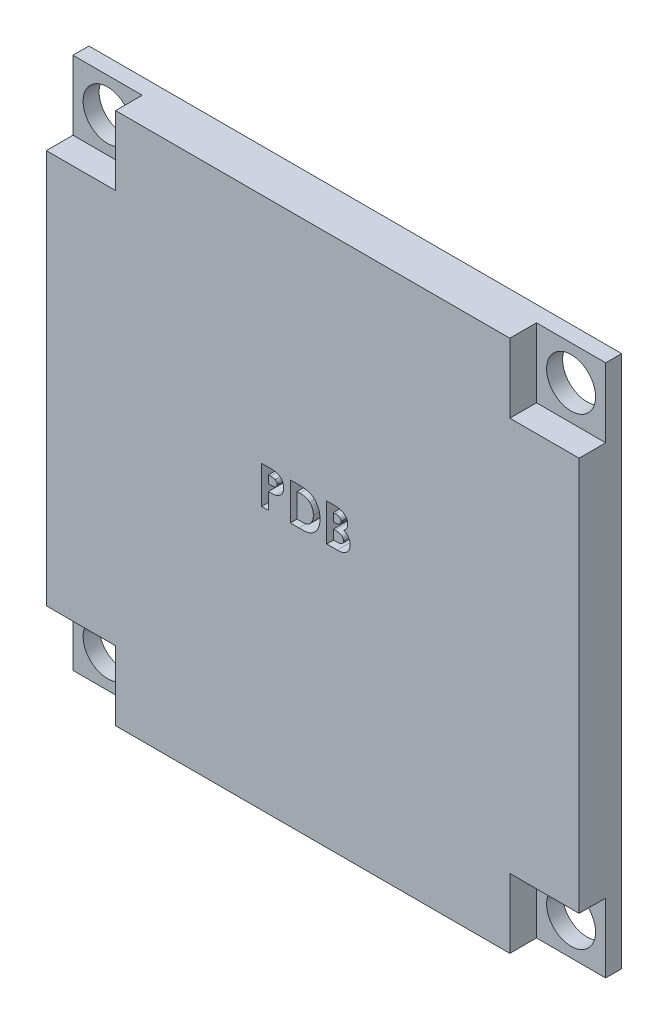
from build123d import *

# Parameters (mm, degrees)
SKETCH1_W           = 50
SKETCH1_H           = 50
BOSS_EXTRUDE1_DEPTH = 4
SKETCH2_W           = 6.5
SKETCH2_H           = 6.5
CUT_EXTRUDE1_DEPTH  = 2.5
SKETCH3_R           = 2.298097039
CUT_EXTRUDE2_DEPTH  = 2.5
CUT_EXTRUDE3_DEPTH  = 2


with BuildPart() as part:
    # Sketch1 → Boss-Extrude1 (new body)
    with BuildSketch(Plane.XY):
        Rectangle(SKETCH1_W, SKETCH1_H)
    extrude(amount=BOSS_EXTRUDE1_DEPTH)

    # Sketch2 → Cut-Extrude1 (cut)
    with BuildSketch(Plane.XY.offset(4)):
        with Locations((21.75, 21.75)):
            Rectangle(SKETCH2_W, SKETCH2_H)
        with Locations((21.75, -21.75)):
            Rectangle(SKETCH2_W, SKETCH2_H)
        with Locations((-21.75, -21.75)):
            Rectangle(SKETCH2_W, SKETCH2_H)
        with Locations((-21.75, 21.75)):
            Rectangle(SKETCH2_W, SKETCH2_H)
    extrude(amount=-CUT_EXTRUDE1_DEPTH, mode=Mode.SUBTRACT)

    # Sketch3 → Cut-Extrude2 (cut)
    with BuildSketch(Plane.XY.offset(1.5)):
        with Locations((-21.75, 21.75)):
            Circle(SKETCH3_R)
        with Locations((21.75, 21.75)):
            Circle(SKETCH3_R)
        with Locations((21.75, -21.75)):
            Circle(SKETCH3_R)
        with Locations((-21.75, -21.75)):
            Circle(SKETCH3_R)
    extrude(amount=-CUT_EXTRUDE2_DEPTH, mode=Mode.SUBTRACT)

    # Sketch4 → Cut-Extrude3 (cut)
    # profile 1 of 3: a face of its own
    with BuildSketch(Plane.XY.offset(4)):
        with BuildLine():
            Line((-4.787653568, 3.184666124), (-4.086531773, 3.184666124))
            add(Edge.make_bspline(
                [(-4.086531773, 3.184666124), (-4.040721385, 3.184461067), (-3.952343543, 3.184065469), (-3.824895424, 3.179268317), (-3.707318293, 3.170671528), (-3.599639165, 3.160047256), (-3.501902315, 3.14515244), (-3.413985345, 3.1280767), (-3.335870012, 3.107273478), (-3.266675449, 3.082580343), (-3.204575564, 3.053468101), (-3.145809043, 3.022461485), (-3.091704017, 2.985456183), (-3.039529642, 2.946440469), (-2.992268816, 2.901687186), (-2.946973126, 2.854174731), (-2.905560969, 2.802018798), (-2.867840455, 2.745850721), (-2.833622137, 2.686708246), (-2.803726725, 2.624485644), (-2.779477241, 2.559084454), (-2.759134939, 2.490927748), (-2.742795804, 2.420018495), (-2.731919956, 2.345920598), (-2.724532533, 2.269151436), (-2.723880694, 2.216902296), (-2.723551004, 2.190475419)],
                knots=[0, 0, 0, 0, 1.698747864, 3.27724071, 4.728299578, 6.070144658, 7.288476769, 8.393259625, 9.389771311, 10.283485332, 11.113357557, 11.931608583, 12.74405601, 13.541433047, 14.344816069, 15.154114104, 15.974336324, 16.810834471, 17.661136416, 18.50621059, 19.367396281, 20.244825668, 21.142564693, 22.063065223, 23.020325768, 24, 24, 24, 24], degree=3))
            add(Edge.make_bspline(
                [(-2.723551004, 2.190475419), (-2.724028025, 2.161239995), (-2.724965429, 2.103788794), (-2.734155016, 2.019572381), (-2.749853733, 1.939279656), (-2.770371134, 1.862233497), (-2.798981192, 1.789701482), (-2.831666839, 1.719952977), (-2.871880553, 1.654943515), (-2.91783115, 1.593859906), (-2.968014444, 1.536205511), (-3.023621784, 1.483644993), (-3.083593271, 1.435820047), (-3.147581752, 1.392229465), (-3.215827457, 1.352961178), (-3.288281144, 1.317647482), (-3.365437569, 1.287417816), (-3.419166982, 1.271607946), (-3.446407574, 1.263592406)],
                knots=[0, 0, 0, 0, 1.102006807, 2.165578795, 3.188629044, 4.184801286, 5.166646146, 6.124351954, 7.085497154, 8.042432466, 9.003981491, 9.963833307, 10.922997304, 11.89326795, 12.880200226, 13.889073926, 14.929769137, 16, 16, 16, 16], degree=3))
            add(Edge.make_bspline(
                [(-3.446407574, 1.263592406), (-3.464349795, 1.259128353), (-3.503218424, 1.249457775), (-3.567535327, 1.239639712), (-3.641653806, 1.230612606), (-3.725813533, 1.222854901), (-3.820063029, 1.21758147), (-3.924311035, 1.213463154), (-4.038604795, 1.210468714), (-4.118080156, 1.210362458), (-4.15944844, 1.21030715)],
                knots=[0, 0, 0, 0, 0.618981996, 1.340914327, 2.176866532, 3.120127938, 4.170906482, 5.338178032, 6.614476169, 8, 8, 8, 8], degree=3))
            Line((-4.15944844, 1.21030715), (-4.15944844, -0.315333876))
            Line((-4.15944844, -0.315333876), (-4.787653568, -0.315333876))
            Line((-4.787653568, -0.315333876), (-4.787653568, 3.184666124))
        make_face()
        with BuildLine():
            Line((-4.15944844, 1.838512278), (-3.937192831, 1.838512278))
            add(Edge.make_bspline(
                [(-3.937192831, 1.838512278), (-3.896749914, 1.838768718), (-3.822334346, 1.83924057), (-3.720708958, 1.846063831), (-3.639040842, 1.856484329), (-3.574521514, 1.871429732), (-3.523577393, 1.894111361), (-3.479641279, 1.920349734), (-3.441956151, 1.953527436), (-3.409326378, 1.991438638), (-3.383239857, 2.03500051), (-3.365150214, 2.08350373), (-3.353399537, 2.135929194), (-3.352314253, 2.172413847), (-3.351756132, 2.191176541)],
                knots=[0, 0, 0, 0, 1.8619151, 3.425951444, 4.686033666, 5.651700536, 6.461346321, 7.243864085, 7.999046032, 8.762387399, 9.539336099, 10.322741239, 11.137448474, 12, 12, 12, 12], degree=3))
            add(Edge.make_bspline(
                [(-3.351756132, 2.191176541), (-3.352308512, 2.207569263), (-3.353380262, 2.239375084), (-3.36125363, 2.285278773), (-3.373801514, 2.328070481), (-3.391982915, 2.367303304), (-3.415487162, 2.402910581), (-3.444143595, 2.434878284), (-3.477584497, 2.463891028), (-3.503402828, 2.479247917), (-3.516519754, 2.487049938)],
                knots=[0, 0, 0, 0, 1.102301479, 2.1387299, 3.123554645, 4.094223062, 5.036071848, 5.982632524, 6.975082478, 8, 8, 8, 8], degree=3))
            add(Edge.make_bspline(
                [(-3.516519754, 2.487049938), (-3.527630547, 2.492668985), (-3.551154374, 2.504565659), (-3.591217732, 2.518396412), (-3.637450234, 2.530064176), (-3.690164004, 2.539748307), (-3.74914875, 2.547264199), (-3.814393948, 2.553011975), (-3.885995614, 2.55532338), (-3.935790288, 2.556071332), (-3.961732094, 2.556460996)],
                knots=[0, 0, 0, 0, 0.656809284, 1.390599849, 2.23162475, 3.173112763, 4.218524733, 5.370385145, 6.63003504, 8, 8, 8, 8], degree=3))
            Line((-3.961732094, 2.556460996), (-4.15944844, 2.556460996))
            Line((-4.15944844, 2.556460996), (-4.15944844, 1.838512278))
        make_face(mode=Mode.SUBTRACT)
    # profile 2 of 3: a face of its own
    with BuildSketch(Plane.XY.offset(4)):
        with BuildLine():
            Line((-2.095345876, 3.184666124), (-1.303779369, 3.184666124))
            add(Edge.make_bspline(
                [(-1.303779369, 3.184666124), (-1.242067656, 3.184234738), (-1.122778215, 3.183400864), (-0.949951415, 3.17400511), (-0.789244484, 3.159555106), (-0.640553827, 3.139676507), (-0.504184283, 3.113371677), (-0.380311698, 3.080377423), (-0.268520327, 3.042291046), (-0.1675844, 2.997474695), (-0.075439607, 2.94522328), (0.012054815, 2.8870194), (0.094727073, 2.820730874), (0.17373734, 2.747636542), (0.248065973, 2.666399165), (0.31895081, 2.578364328), (0.384656268, 2.482255405), (0.447168481, 2.380376784), (0.503702459, 2.272296713), (0.553013507, 2.158935148), (0.594321672, 2.041021613), (0.627886694, 1.918430442), (0.654641891, 1.791568601), (0.673361963, 1.660180095), (0.684934898, 1.524386566), (0.686108875, 1.432352625), (0.686705406, 1.385587599)],
                knots=[0, 0, 0, 0, 1.44355588, 2.790409838, 4.047694926, 5.217575253, 6.298404546, 7.294384826, 8.214239204, 9.058592145, 9.873746385, 10.689560431, 11.514393297, 12.350027578, 13.205127629, 14.088021785, 14.991911688, 15.926770944, 16.882954281, 17.842803888, 18.816321264, 19.80318086, 20.814351908, 21.847355356, 22.906180909, 24, 24, 24, 24], degree=3))
            add(Edge.make_bspline(
                [(0.686705406, 1.385587599), (0.685143366, 1.319599103), (0.6820684, 1.189696887), (0.656166596, 0.999066882), (0.614274609, 0.816329008), (0.555370671, 0.642912713), (0.482345556, 0.480362295), (0.395108879, 0.331544261), (0.294939732, 0.197257392), (0.183005093, 0.078170326), (0.06180714, -0.024186622), (-0.064141973, -0.111847857), (-0.19606922, -0.180976055), (-0.312315561, -0.22481367), (-0.413115642, -0.252076874), (-0.501617022, -0.268189691), (-0.60214556, -0.282966115), (-0.715638597, -0.294385017), (-0.841598263, -0.304567872), (-0.980526636, -0.31010084), (-1.131973905, -0.314697914), (-1.237168353, -0.315116334), (-1.291860299, -0.315333876)],
                knots=[0, 0, 0, 0, 1.315458931, 2.589557908, 3.828601765, 5.048913369, 6.235739168, 7.376350998, 8.481830359, 9.569842114, 10.627874879, 11.640079404, 12.624025415, 13.590060155, 14.111227486, 14.704434459, 15.382649715, 16.137166398, 16.978595427, 17.902333227, 18.909396075, 20, 20, 20, 20], degree=3))
            Line((-1.291860299, -0.315333876), (-2.095345876, -0.315333876))
            Line((-2.095345876, -0.315333876), (-2.095345876, 3.184666124))
        make_face()
        with BuildLine():
            Line((-1.467140748, 2.556460996), (-1.467140748, 0.312871253))
            Line((-1.467140748, 0.312871253), (-1.139015748, 0.312871253))
            add(Edge.make_bspline(
                [(-1.139015748, 0.312871253), (-1.099973912, 0.312942793), (-1.024883464, 0.31308039), (-0.916469856, 0.319634244), (-0.816214757, 0.326212506), (-0.724394147, 0.338698267), (-0.640339784, 0.352606526), (-0.565206354, 0.371961773), (-0.497445031, 0.39229282), (-0.437883507, 0.418176764), (-0.383330004, 0.447310864), (-0.332819691, 0.481444841), (-0.284063098, 0.519349335), (-0.237971767, 0.562139171), (-0.194371255, 0.609247731), (-0.15351953, 0.660917745), (-0.114871329, 0.716991566), (-0.079418678, 0.777765671), (-0.047021856, 0.84259827), (-0.018282244, 0.910861367), (0.005547135, 0.983123445), (0.025352656, 1.058708044), (0.039505946, 1.138273214), (0.051215094, 1.221229627), (0.057251501, 1.30790595), (0.058079961, 1.366883417), (0.058500278, 1.396805547)],
                knots=[0, 0, 0, 0, 1.50275155, 2.890291501, 4.180787663, 5.369391935, 6.45668281, 7.458360028, 8.354766181, 9.177074746, 9.954075863, 10.732690366, 11.5210699, 12.329727389, 13.151100085, 13.990027547, 14.863562427, 15.770965086, 16.696477834, 17.652329173, 18.619756807, 19.62365428, 20.657822005, 21.729286259, 22.847956731, 24, 24, 24, 24], degree=3))
            add(Edge.make_bspline(
                [(0.058500278, 1.396805547), (0.057663148, 1.442658384), (0.05603081, 1.532067863), (0.040288891, 1.662294721), (0.014664049, 1.784922816), (-0.02190013, 1.899497043), (-0.067990412, 2.006339416), (-0.125683144, 2.104544753), (-0.192495452, 2.195762769), (-0.245328803, 2.249274185), (-0.271728087, 2.276012278)],
                knots=[0, 0, 0, 0, 1.13821349, 2.219428113, 3.251817212, 4.244760574, 5.201143372, 6.134805572, 7.068016741, 8, 8, 8, 8], degree=3))
            add(Edge.make_bspline(
                [(-0.271728087, 2.276012278), (-0.297760281, 2.298796749), (-0.35092809, 2.345331449), (-0.444273291, 2.401091921), (-0.547134867, 2.450082961), (-0.661865985, 2.488927393), (-0.787357817, 2.519647225), (-0.924357796, 2.540833942), (-1.072132258, 2.554448302), (-1.174506962, 2.555775725), (-1.227357094, 2.556460996)],
                knots=[0, 0, 0, 0, 0.813307809, 1.661089106, 2.549956539, 3.493439533, 4.508053171, 5.589449661, 6.755572447, 8, 8, 8, 8], degree=3))
            Line((-1.227357094, 2.556460996), (-1.467140748, 2.556460996))
        make_face(mode=Mode.SUBTRACT)
    # profile 3 of 3: a face of its own
    with BuildSketch(Plane.XY.offset(4)):
        with BuildLine():
            Line((1.314910535, -0.315333876), (1.314910535, 3.184666124))
            Line((1.314910535, 3.184666124), (1.87580797, 3.184666124))
            add(Edge.make_bspline(
                [(1.87580797, 3.184666124), (1.915074298, 3.184670606), (1.991053898, 3.184679277), (2.100672631, 3.180829827), (2.202334749, 3.175850132), (2.295716722, 3.170279011), (2.380977494, 3.160678858), (2.457987412, 3.150561344), (2.526900342, 3.138360246), (2.569505462, 3.127415484), (2.589549958, 3.122266285)],
                knots=[0, 0, 0, 0, 1.311965854, 2.538629056, 3.664479157, 4.713267157, 5.663616078, 6.530575999, 7.308677837, 8, 8, 8, 8], degree=3))
            add(Edge.make_bspline(
                [(2.589549958, 3.122266285), (2.615870416, 3.115003247), (2.667519605, 3.100750837), (2.741497726, 3.071967477), (2.811676293, 3.039972732), (2.877969621, 3.003472713), (2.93997064, 2.96202676), (2.997443728, 2.915305948), (3.051628435, 2.865185647), (3.100600787, 2.810269019), (3.144863725, 2.752239428), (3.183320281, 2.691112081), (3.2167341, 2.627821653), (3.243473907, 2.561571678), (3.263621849, 2.492667254), (3.27835797, 2.421402614), (3.287908972, 2.347552259), (3.288811416, 2.297309449), (3.289269509, 2.271805547)],
                knots=[0, 0, 0, 0, 1.099996261, 2.158545794, 3.195537121, 4.207578794, 5.205712374, 6.197378256, 7.190519799, 8.17788031, 9.159561366, 10.129234751, 11.085776129, 12.040971148, 13.00380137, 13.975669004, 14.972423361, 16, 16, 16, 16], degree=3))
            add(Edge.make_bspline(
                [(3.289269509, 2.271805547), (3.288071733, 2.239039728), (3.285714059, 2.17454424), (3.270653075, 2.079812035), (3.242411383, 1.990276486), (3.205457816, 1.904287485), (3.155212518, 1.822165773), (3.091410707, 1.743950395), (3.015085764, 1.667232984), (2.956540319, 1.62124607), (2.926088419, 1.597326381)],
                knots=[0, 0, 0, 0, 0.986156485, 1.941127874, 2.875419072, 3.804401753, 4.751181392, 5.761612777, 6.835722519, 8, 8, 8, 8], degree=3))
            add(Edge.make_bspline(
                [(2.926088419, 1.597326381), (2.950765178, 1.584729109), (2.999149474, 1.560029346), (3.067840961, 1.519430308), (3.131441779, 1.476248081), (3.190237095, 1.431351511), (3.242993611, 1.382837366), (3.291889732, 1.333501097), (3.334513177, 1.280515942), (3.372628345, 1.225770393), (3.405757431, 1.168471728), (3.434609211, 1.108716711), (3.458979274, 1.046301206), (3.479616474, 0.981542857), (3.495007704, 0.914218927), (3.505043113, 0.844305336), (3.512726849, 0.772040527), (3.513324571, 0.722815544), (3.513628483, 0.697787118)],
                knots=[0, 0, 0, 0, 1.164658916, 2.283573913, 3.35186032, 4.395461096, 5.390182219, 6.362969632, 7.312859996, 8.245001507, 9.165155236, 10.092416118, 11.032087915, 11.979892451, 12.947605196, 13.931445124, 14.948243989, 16, 16, 16, 16], degree=3))
            add(Edge.make_bspline(
                [(3.513628483, 0.697787118), (3.511656299, 0.649984256), (3.507764201, 0.555645499), (3.47930708, 0.417134537), (3.429971475, 0.285813583), (3.36372393, 0.162204561), (3.282094209, 0.049885751), (3.188243439, -0.048504552), (3.083116481, -0.131789759), (2.986124156, -0.188000813), (2.902233434, -0.225723687), (2.832748315, -0.249046346), (2.758122771, -0.270652422), (2.67698984, -0.285824655), (2.590820352, -0.299711951), (2.498774149, -0.308286255), (2.401023263, -0.31409685), (2.333883729, -0.314913197), (2.299285535, -0.315333876)],
                knots=[0, 0, 0, 0, 1.284142165, 2.534249414, 3.780121997, 5.041676246, 6.291546858, 7.49970053, 8.684500223, 9.883330709, 10.50184324, 11.153274765, 11.851151195, 12.587658647, 13.369265475, 14.195992086, 15.070362669, 16, 16, 16, 16], degree=3))
            Line((2.299285535, -0.315333876), (1.314910535, -0.315333876))
        make_face()
        with BuildLine():
            Line((1.943115663, 2.556460996), (1.943115663, 1.793640483))
            Line((1.943115663, 1.793640483), (2.10998265, 1.793640483))
            add(Edge.make_bspline(
                [(2.10998265, 1.793640483), (2.132661373, 1.79383825), (2.176441275, 1.794220028), (2.239676699, 1.799137187), (2.298475431, 1.807526166), (2.352614461, 1.819230902), (2.402598113, 1.83409421), (2.448107077, 1.851977971), (2.488941258, 1.873798102), (2.536381132, 1.906300152), (2.586528499, 1.954128372), (2.630672663, 2.023226147), (2.656673281, 2.102688324), (2.659569049, 2.158731205), (2.661064381, 2.187670932)],
                knots=[0, 0, 0, 0, 1.065314748, 2.056525647, 2.977365736, 3.853934255, 4.656397591, 5.425096493, 6.14721249, 6.826394842, 8.123232004, 9.372140726, 10.643011755, 12, 12, 12, 12], degree=3))
            add(Edge.make_bspline(
                [(2.661064381, 2.187670932), (2.659867841, 2.214777795), (2.65755438, 2.267187824), (2.631375101, 2.340776173), (2.590713505, 2.405990512), (2.542706776, 2.450624393), (2.497499112, 2.481108018), (2.458789535, 2.501180187), (2.416302869, 2.519148587), (2.369216616, 2.532887664), (2.317799664, 2.543196984), (2.262301774, 2.550767944), (2.202627195, 2.555921062), (2.161409835, 2.556277158), (2.140130887, 2.556460996)],
                knots=[0, 0, 0, 0, 1.347982417, 2.606269829, 3.849316587, 5.153353503, 5.842674298, 6.568177932, 7.326619318, 8.142485038, 9.012069166, 9.942760135, 10.937925643, 12, 12, 12, 12], degree=3))
            Line((2.140130887, 2.556460996), (1.943115663, 2.556460996))
        make_face(mode=Mode.SUBTRACT)
        with BuildLine():
            Line((1.943115663, 1.21030715), (1.943115663, 0.312871253))
            Line((1.943115663, 0.312871253), (2.124005086, 0.312871253))
            add(Edge.make_bspline(
                [(2.124005086, 0.312871253), (2.159767155, 0.31307556), (2.228524196, 0.313468366), (2.327018535, 0.318214402), (2.416574512, 0.326768295), (2.496954839, 0.337447141), (2.568282633, 0.351915308), (2.630316789, 0.370309727), (2.683908024, 0.390546793), (2.728735004, 0.415541971), (2.765356079, 0.444630161), (2.798402759, 0.474358989), (2.825346963, 0.508654002), (2.846665719, 0.546043008), (2.865117066, 0.585597238), (2.876245615, 0.628861271), (2.884718502, 0.674552864), (2.885184787, 0.706156751), (2.885423355, 0.722326381)],
                knots=[0, 0, 0, 0, 1.753078804, 3.370512758, 4.83203934, 6.162291463, 7.344201807, 8.395507345, 9.331626367, 10.147333109, 10.898971645, 11.62040215, 12.321813352, 13.025280112, 13.727906689, 14.453419512, 15.208716525, 16, 16, 16, 16], degree=3))
            add(Edge.make_bspline(
                [(2.885423355, 0.722326381), (2.884897245, 0.740816606), (2.883872524, 0.776830592), (2.875503614, 0.829468875), (2.86029457, 0.878610205), (2.841138038, 0.925511192), (2.814480706, 0.968492617), (2.782799378, 1.009041904), (2.744520245, 1.045785929), (2.701473127, 1.080947109), (2.651262927, 1.111732627), (2.593866086, 1.138444516), (2.528970793, 1.160753303), (2.45637603, 1.178515573), (2.376400045, 1.193590167), (2.288459101, 1.202591363), (2.193285602, 1.209285948), (2.127290749, 1.209959015), (2.093155727, 1.21030715)],
                knots=[0, 0, 0, 0, 0.845221588, 1.646264278, 2.427170338, 3.19324141, 3.95557735, 4.731569926, 5.540061037, 6.376114724, 7.268642756, 8.224665384, 9.265483498, 10.400594375, 11.639216012, 12.983232105, 14.439614077, 16, 16, 16, 16], degree=3))
            Line((2.093155727, 1.21030715), (1.943115663, 1.21030715))
        make_face(mode=Mode.SUBTRACT)
    extrude(amount=-CUT_EXTRUDE3_DEPTH, mode=Mode.SUBTRACT)


solid = part.part
